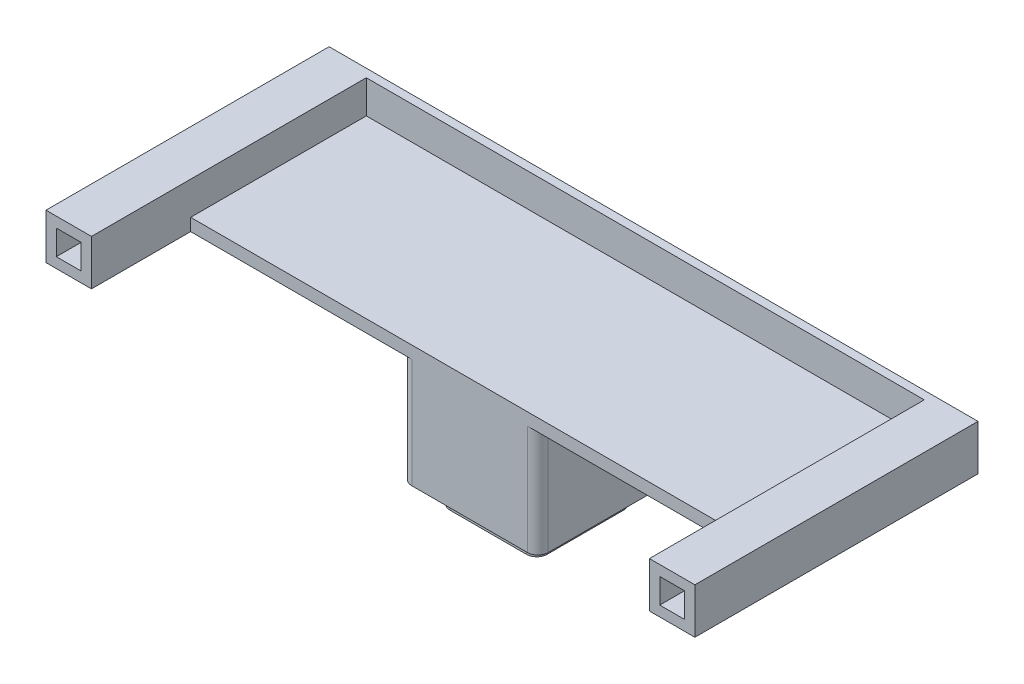
from build123d import *

# Parameters (mm, degrees)
ESQUISSE1_W             = 314
ESQUISSE1_H             = 137
BOSS_EXTRU_1_DEPTH      = 85
ESQUISSE2_W             = 124
ESQUISSE2_H             = 137
ENL_V_MAT_EXTRU_1_DEPTH = 63
ESQUISSE3_W             = 124
ESQUISSE3_H             = 137
ENL_V_MAT_EXTRU_2_DEPTH = 63
ESQUISSE4_W             = 66
ESQUISSE4_H             = 25
ENL_V_MAT_EXTRU_3_DEPTH = 63
ESQUISSE7_W             = 270
ESQUISSE7_H             = 133
ENL_V_MAT_EXTRU_6_DEPTH = 16
ESQUISSE8_W             = 12
ESQUISSE8_H             = 12
ENL_V_MAT_EXTRU_7_DEPTH = 140
ESQUISSE9_W             = 270
ESQUISSE9_H             = 48
ENL_V_MAT_EXTRU_8_DEPTH = 140
ESQUISSE5_W             = 35
ESQUISSE5_H             = 35
ENL_V_MAT_EXTRU_4_DEPTH = 38
ESQUISSE6_W             = 66
ESQUISSE6_H             = 64
ESQUISSE6_W_2           = 47
ESQUISSE6_H_2           = 47
ENL_V_MAT_EXTRU_5_DEPTH = 10
CONG_1_R                = 5
CONG_2_R                = 5


with BuildPart() as part:
    # Esquisse1 → Boss.-Extru.1 (new body)
    with BuildSketch(Plane(origin=(0, 0, 0), x_dir=(1, 0, 0), z_dir=(0, 1, 0))):
        with Locations((157, 68.5)):
            Rectangle(ESQUISSE1_W, ESQUISSE1_H)
    extrude(amount=BOSS_EXTRU_1_DEPTH)

    # Esquisse2 → Enlèv. mat.-Extru.1 (cut)
    with BuildSketch(Plane.XZ):
        with Locations((62, -68.5)):
            Rectangle(ESQUISSE2_W, ESQUISSE2_H)
    extrude(amount=-ENL_V_MAT_EXTRU_1_DEPTH, mode=Mode.SUBTRACT)

    # Esquisse3 → Enlèv. mat.-Extru.2 (cut)
    with BuildSketch(Plane(origin=(0, 0, 0), x_dir=(-1, 0, 0), z_dir=(0, -1, 0))):
        with Locations((-252, 68.5)):
            Rectangle(ESQUISSE3_W, ESQUISSE3_H)
    extrude(amount=-ENL_V_MAT_EXTRU_2_DEPTH, mode=Mode.SUBTRACT)

    # Esquisse4 → Enlèv. mat.-Extru.3 (cut)
    with BuildSketch(Plane.XZ):
        with Locations((157, -124.5)):
            Rectangle(ESQUISSE4_W, ESQUISSE4_H)
    extrude(amount=-ENL_V_MAT_EXTRU_3_DEPTH, mode=Mode.SUBTRACT)

    # Esquisse7 → Enlèv. mat.-Extru.6 (cut)
    with BuildSketch(Plane(origin=(0, 85, 0), x_dir=(1, 0, 0), z_dir=(0, 1, 0))):
        with Locations((157, 66.5)):
            Rectangle(ESQUISSE7_W, ESQUISSE7_H)
    extrude(amount=-ENL_V_MAT_EXTRU_6_DEPTH, mode=Mode.SUBTRACT)

    # Esquisse8 → Enlèv. mat.-Extru.7 (cut)
    with BuildSketch(Plane.XY):
        with Locations((11, 74)):
            Rectangle(ESQUISSE8_W, ESQUISSE8_H)
        with Locations((303, 74)):
            Rectangle(ESQUISSE8_W, ESQUISSE8_H)
    extrude(amount=-ENL_V_MAT_EXTRU_7_DEPTH, mode=Mode.SUBTRACT)

    # Esquisse9 → Enlèv. mat.-Extru.8 (cut)
    with BuildSketch(Plane(origin=(0, 85, 0), x_dir=(1, 0, 0), z_dir=(0, 1, 0))):
        with Locations((157, 24)):
            Rectangle(ESQUISSE9_W, ESQUISSE9_H)
    extrude(amount=-ENL_V_MAT_EXTRU_8_DEPTH, mode=Mode.SUBTRACT)

    # Esquisse5 → Enlèv. mat.-Extru.4 (cut)
    with BuildSketch(Plane.XZ):
        with Locations((157, -80.5)):
            Rectangle(ESQUISSE5_W, ESQUISSE5_H)
    extrude(amount=-ENL_V_MAT_EXTRU_4_DEPTH, mode=Mode.SUBTRACT)

    # Esquisse6 → Enlèv. mat.-Extru.5 (cut)
    with BuildSketch(Plane(origin=(0, 0, 0), x_dir=(-1, 0, 0), z_dir=(0, -1, 0))):
        with Locations((-157, 80)):
            Rectangle(ESQUISSE6_W, ESQUISSE6_H)
        with Locations((-157, 80.5)):
            Rectangle(ESQUISSE6_W_2, ESQUISSE6_H_2, mode=Mode.SUBTRACT)
    extrude(amount=-ENL_V_MAT_EXTRU_5_DEPTH, mode=Mode.SUBTRACT)

    # Congé1
    cong_1_edges = [part.edges().sort_by_distance(p)[0] for p in [
        (180.5, 5, -57),
        (133.5, 5, -57),
        (133.5, 5, -104),
        (180.5, 5, -104),
    ]]
    fillet(cong_1_edges, radius=CONG_1_R)

    # Congé2
    cong_2_edges = [part.edges().sort_by_distance(p)[0] for p in [
        (190, 36.5, -48),
        (124, 36.5, -48),
        (124, 36.5, -112),
        (190, 36.5, -112),
    ]]
    fillet(cong_2_edges, radius=CONG_2_R)


solid = part.part
